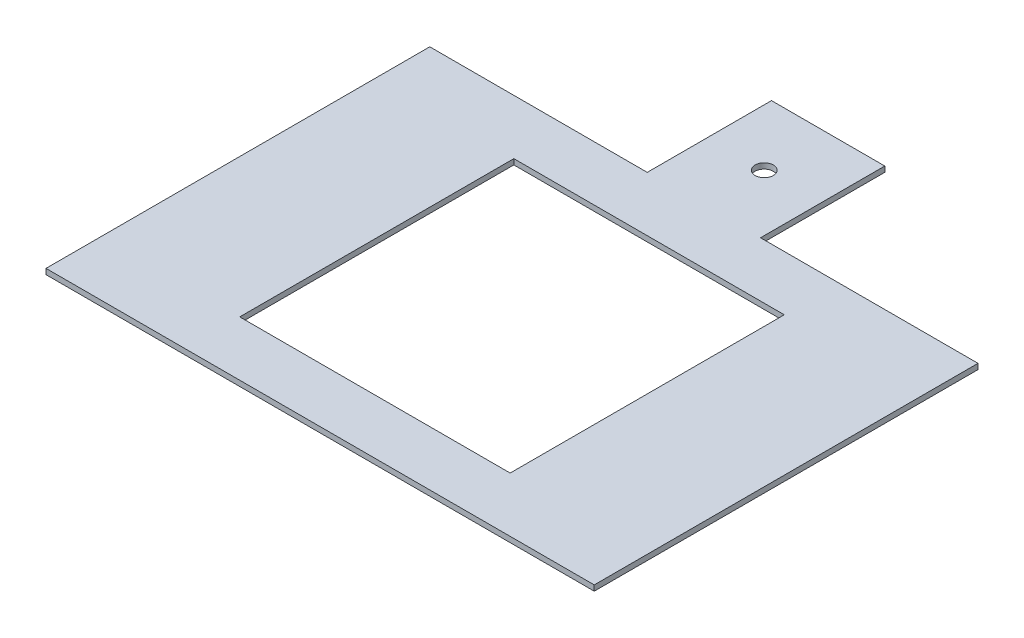
from build123d import *

# Parameters (mm, degrees)
SKETCH1_W           = 300
SKETCH1_H           = 210
SKETCH1_W_2         = 148
SKETCH1_H_2         = 150
BOSS_EXTRUDE1_DEPTH = 1.5
SKETCH2_W           = 62
SKETCH2_H           = 68
SKETCH2_R           = 5
BOSS_EXTRUDE2_DEPTH = 3


with BuildPart() as part:
    # Sketch1 → Boss-Extrude1 (new, symmetric)
    with BuildSketch(Plane(origin=(0, 0, 0), x_dir=(1, 0, 0), z_dir=(0, 1, 0))):
        Rectangle(SKETCH1_W, SKETCH1_H)
        Rectangle(SKETCH1_W_2, SKETCH1_H_2, mode=Mode.SUBTRACT)
    extrude(amount=BOSS_EXTRUDE1_DEPTH, both=True)

    # Sketch2 → Boss-Extrude2 (add, through all)
    with BuildSketch(Plane(origin=(0, 1.5, 0), x_dir=(1, 0, 0), z_dir=(0, 1, 0))):
        with Locations((0, 139)):
            Rectangle(SKETCH2_W, SKETCH2_H)
        with Locations(Location((0, 138, 0), (0, 0, 270))):
            Circle(SKETCH2_R, mode=Mode.SUBTRACT)
    extrude(amount=-BOSS_EXTRUDE2_DEPTH)


solid = part.part
